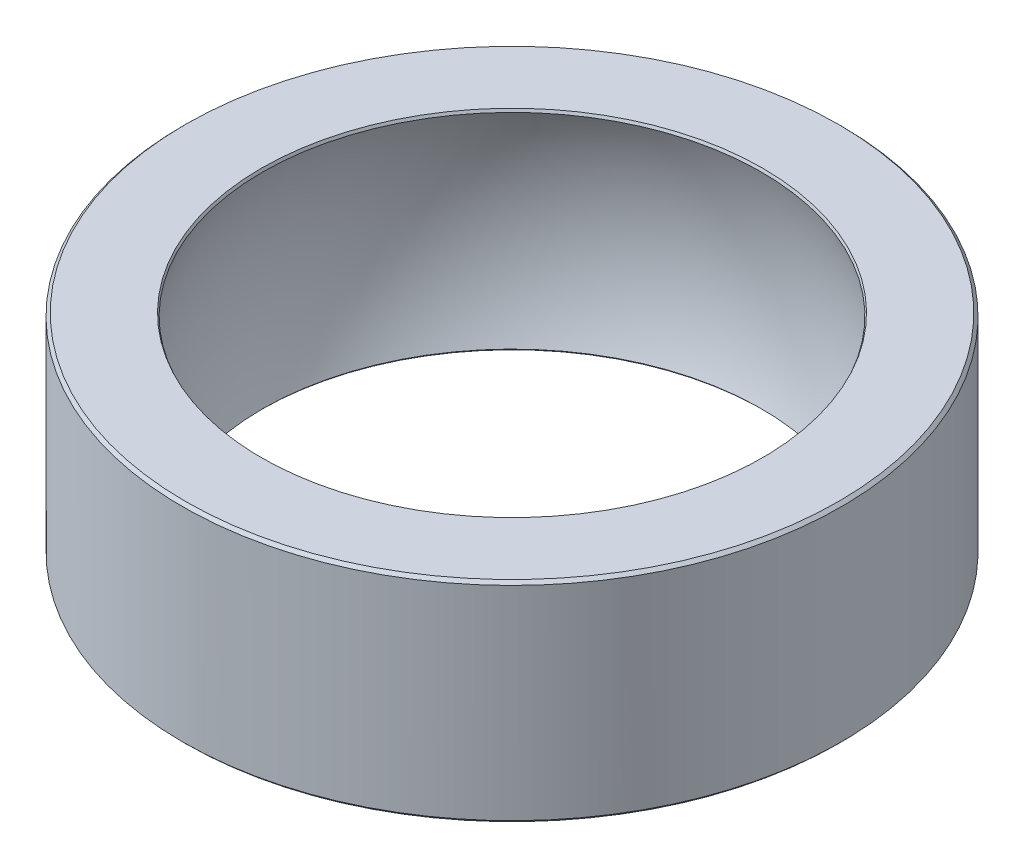
from build123d import *
from OCP.BRepFilletAPI import BRepFilletAPI_MakeChamfer

# Parameters (mm, degrees)
CHAMFER1_SIZE  = 0.1
CHAMFER1_SIZE2 = 0.076325766


with BuildPart() as part:
    # Sketch2 → Revolve1 (revolve)
    with BuildSketch(Plane.XY, mode=Mode.PRIVATE) as revolve1_sk:
        with BuildLine():
            Line((-11, -3.5), (-11, 3.5))
            Line((-11, 3.5), (-8.291561976, 3.5))
            ThreePointArc((-8.291561976, 3.5), (-9, 0), (-8.291561976, -3.5))
            Line((-8.291561976, -3.5), (-11, -3.5))
        make_face()
    revolve(revolve1_sk.sketch.rotate(Axis((0, 0, 0), (0, 1, 0)), 270), axis=Axis((0, 0, 0), (0, 1, 0)))

    # Chamfer1: one chamfer whose edges measure the first distance from different faces: ONE call of the kernel's chamfer builder (chamfer() names one face for all edges)
    chamfer1_edges_1 = [part.edges().sort_by_distance(p)[0] for p in [
        (0, 3.5, 8.291561976),
    ]]
    chamfer1_side_1 = [part.faces().sort_by_distance(p)[0] for p in [
        (0, 0, 9),
    ]]
    chamfer1_edges_2 = [part.edges().sort_by_distance(p)[0] for p in [
        (0, -3.5, 8.291561976),
    ]]
    chamfer1_side_2 = [part.faces().sort_by_distance(p)[0] for p in [
        (0, -3.5, 8.60268896),
    ]]
    chamfer1_edges_3 = [part.edges().sort_by_distance(p)[0] for p in [
        (0, -3.5, 11),
        (0, 3.5, 11),
    ]]
    chamfer1 = BRepFilletAPI_MakeChamfer(part.part.solid().wrapped)
    for e in chamfer1_edges_1:
        chamfer1.Add(CHAMFER1_SIZE, CHAMFER1_SIZE2, e.wrapped, chamfer1_side_1[0].wrapped)  # the first distance lies on this face
    for e in chamfer1_edges_2:
        chamfer1.Add(CHAMFER1_SIZE, CHAMFER1_SIZE2, e.wrapped, chamfer1_side_2[0].wrapped)  # the first distance lies on this face
    for e in chamfer1_edges_3:
        chamfer1.Add(CHAMFER1_SIZE, e.wrapped)
    add(Compound.cast(chamfer1.Shape()), mode=Mode.REPLACE)


solid = part.part
